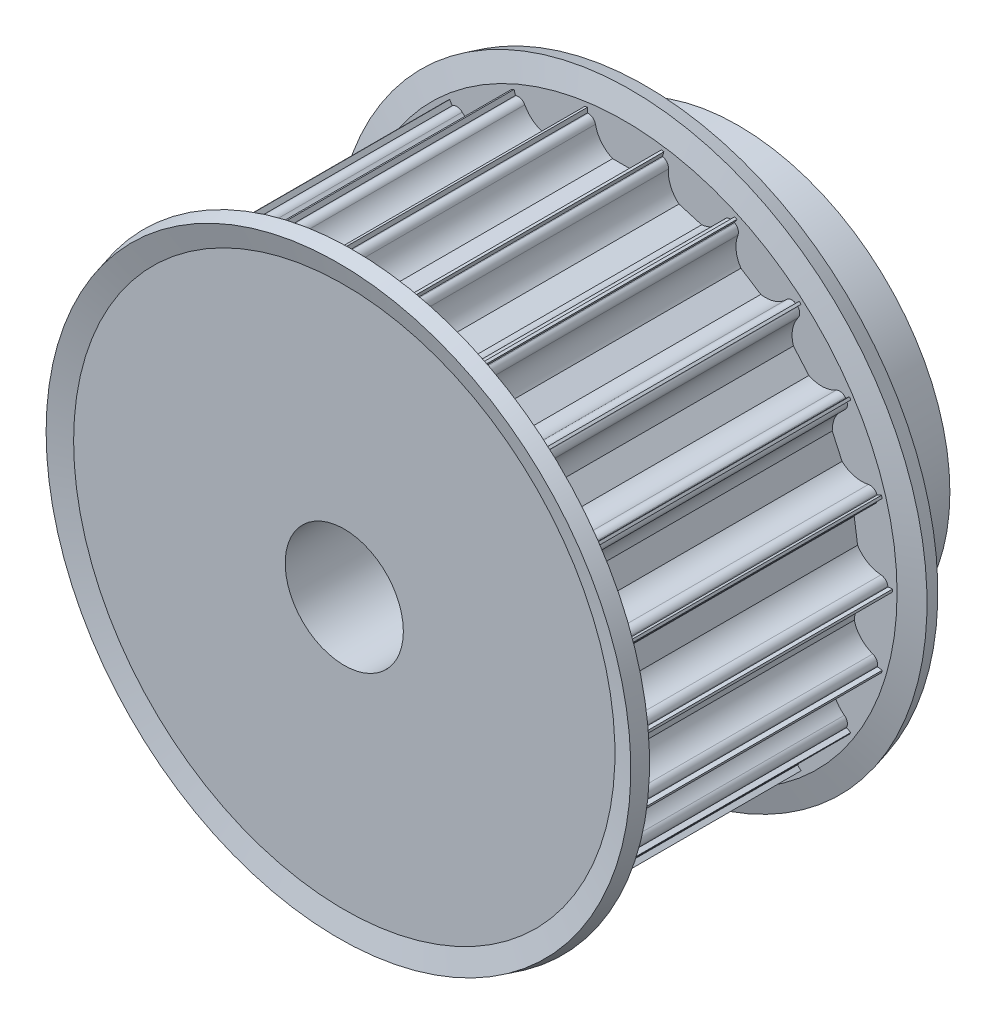
from build123d import *

# Parameters (mm, degrees)
CUT_EXTRUDE1_REACH = 57.544
CIRPATTERN1_COUNT  = 22


with BuildPart() as part:
    # Sketch1 → Revolve1 (revolve)
    with BuildSketch(Plane(origin=(0, 0, 0), x_dir=(0, 0, -1), z_dir=(1, 0, 0)), mode=Mode.PRIVATE) as revolve1_sk:
        Polygon((0, 6), (40, 6), (40, 21.5), (30, 21.5), (30, 27.25), (0, 27.25), align=None)
    revolve(revolve1_sk.sketch.rotate(Axis((0, 0, 0), (0, 0, -1)), 90), axis=Axis((0, 0, 0), (0, 0, -1)))

    # Sketch5 → Cut-Extrude1 (cut, up to next)
    with BuildSketch(Plane.XY, mode=Mode.PRIVATE) as cut_extrude1_sk1:
        with BuildLine():
            Line((-3.674234614, 26.5), (-3.75, 26.5))
            Line((-3.75, 26.5), (-3.75, 28.5))
            Line((-3.75, 28.5), (3.75, 28.5))
            Line((3.75, 28.5), (3.75, 26.5))
            Line((3.75, 26.5), (3.674234614, 26.5))
            ThreePointArc((3.674234614, 26.5), (3.199892965, 26.330947502), (2.939387691, 25.9))
            ThreePointArc((2.939387691, 25.9), (2.331759211, 24.612435701), (1.198957881, 23.75))
            Line((1.198957881, 23.75), (-1.198957881, 23.75))
            ThreePointArc((-1.198957881, 23.75), (-2.331759211, 24.612435701), (-2.939387691, 25.9))
            ThreePointArc((-2.939387691, 25.9), (-3.199892965, 26.330947502), (-3.674234614, 26.5))
        make_face()
    cut_extrude1_tool1 = extrude(cut_extrude1_sk1.sketch, amount=-CUT_EXTRUDE1_REACH, mode=Mode.PRIVATE) & part.part
    cut_extrude1 = cut_extrude1_tool1.solids().sort_by_distance((0, 26.435169, 0))[0]
    add(cut_extrude1, mode=Mode.SUBTRACT)

    # CirPattern1: Cut-Extrude1 ×22 about axis
    cirpattern1_axis = Axis((0, 0, 0), (0, 0, 1))
    for i in range(1, CIRPATTERN1_COUNT):
        add(cut_extrude1.rotate(cirpattern1_axis, i * 360 / CIRPATTERN1_COUNT), mode=Mode.SUBTRACT)

    # Sketch6 → Revolve2 (revolve)
    with BuildSketch(Plane(origin=(0, 0, 0), x_dir=(0, 0, -1), z_dir=(1, 0, 0)), mode=Mode.PRIVATE) as revolve2_sk:
        Polygon((30, 21.5), (30, 27.485554958), (30.590163791, 29.688076211), (29.090163791, 30.09), (28.447085729, 27.69), (28.447085729, 21.5), align=None)
        Polygon((1.552914271, 21.5), (0, 21.5), (0, 27.485554958), (-0.590163791, 29.688076211), (0.909836209, 30.09), (1.552914271, 27.69), align=None)
    revolve(revolve2_sk.sketch.rotate(Axis((0, 0, 0), (0, 0, 1)), 90), axis=Axis((0, 0, 0), (0, 0, 1)))


solid = part.part
